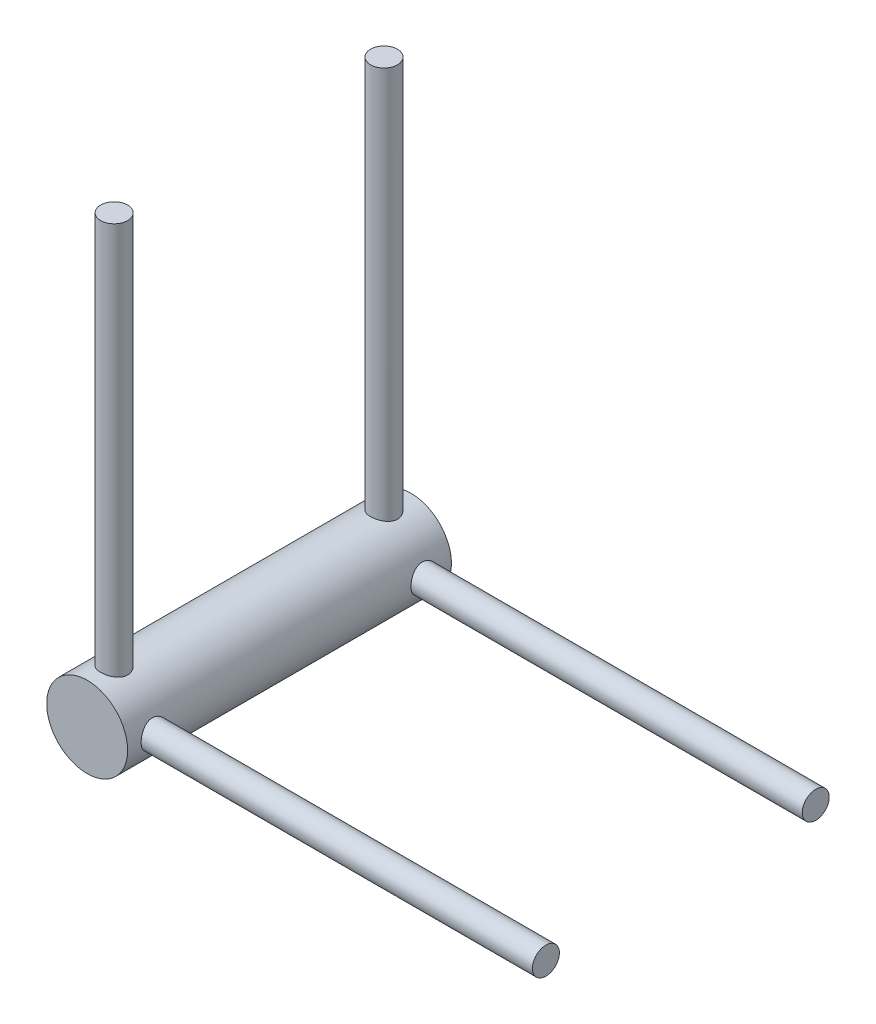
from build123d import *

# Parameters (mm, degrees)
SKETCH1_R           = 9.525
BOSS_EXTRUDE1_DEPTH = 38.1
SKETCH2_R           = 3.175
BOSS_EXTRUDE2_DEPTH = 101.6
SKETCH3_R           = 3.175
BOSS_EXTRUDE3_DEPTH = 101.6


with BuildPart() as part:
    # Sketch1 → Boss-Extrude1 (new, symmetric)
    with BuildSketch(Plane.XY):
        with Locations(Location((0, 0, 0), (0, 0, 180))):
            Circle(SKETCH1_R)
    extrude(amount=BOSS_EXTRUDE1_DEPTH, both=True)

    # Sketch2 → Boss-Extrude2 (add)
    with BuildSketch(Plane(origin=(0, 0, 0), x_dir=(0, 0, -1), z_dir=(1, 0, 0))):
        with Locations((-31.75, 0)):
            Circle(SKETCH2_R)
        with Locations((31.75, 0)):
            Circle(SKETCH2_R)
    extrude(amount=BOSS_EXTRUDE2_DEPTH)

    # Sketch3 → Boss-Extrude3 (add)
    with BuildSketch(Plane(origin=(0, 0, 0), x_dir=(1, 0, 0), z_dir=(0, 1, 0))):
        with Locations(Location((0, 31.75, 0), (0, 0, 90))):
            Circle(SKETCH3_R)
        with Locations(Location((0, -31.75, 0), (0, 0, 90))):
            Circle(SKETCH3_R)
    extrude(amount=BOSS_EXTRUDE3_DEPTH)


solid = part.part
